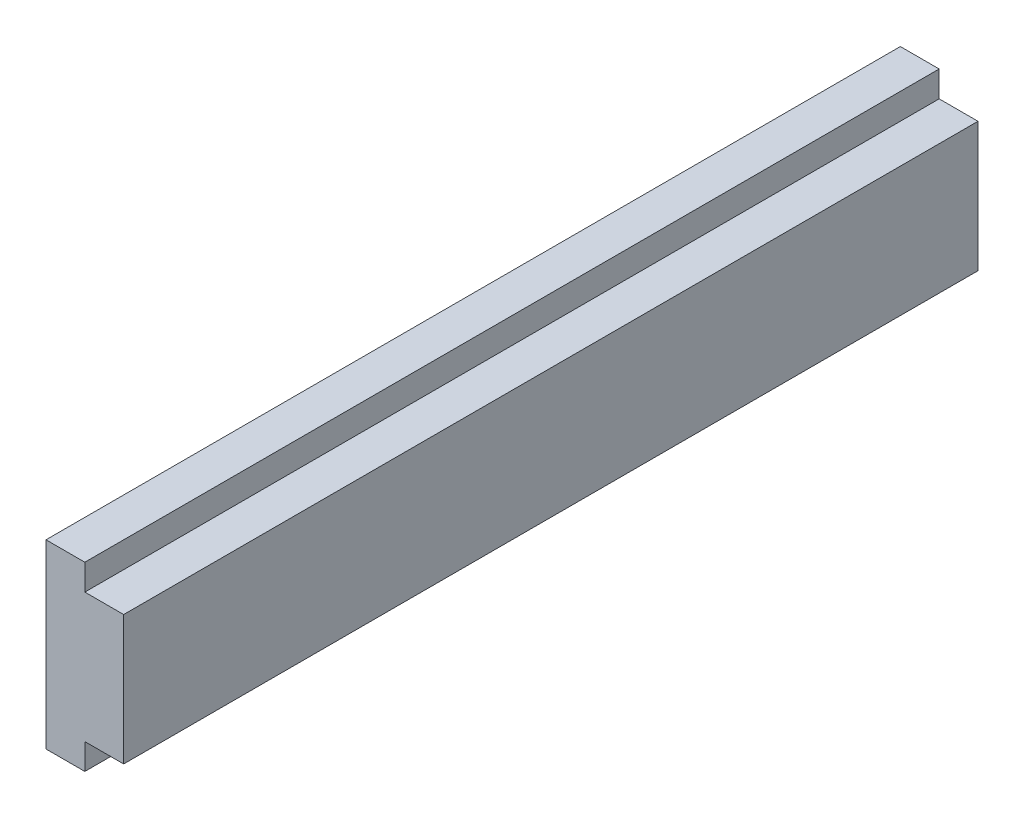
from build123d import *

# Parameters (mm, degrees)
SKETCH_1_W      = 3
SKETCH_1_H      = 14
SKETCH_1_H_2    = 10
EXTRUDE_1_DEPTH = 66


with BuildPart() as part:
    # 스케치1 → 보스-돌출1 (new body)
    with BuildSketch(Plane.XY):
        with Locations((1.5, 7)):
            Rectangle(SKETCH_1_W, SKETCH_1_H)
        with Locations((4.5, 7)):
            Rectangle(SKETCH_1_W, SKETCH_1_H_2)
    extrude(amount=EXTRUDE_1_DEPTH)


solid = part.part
